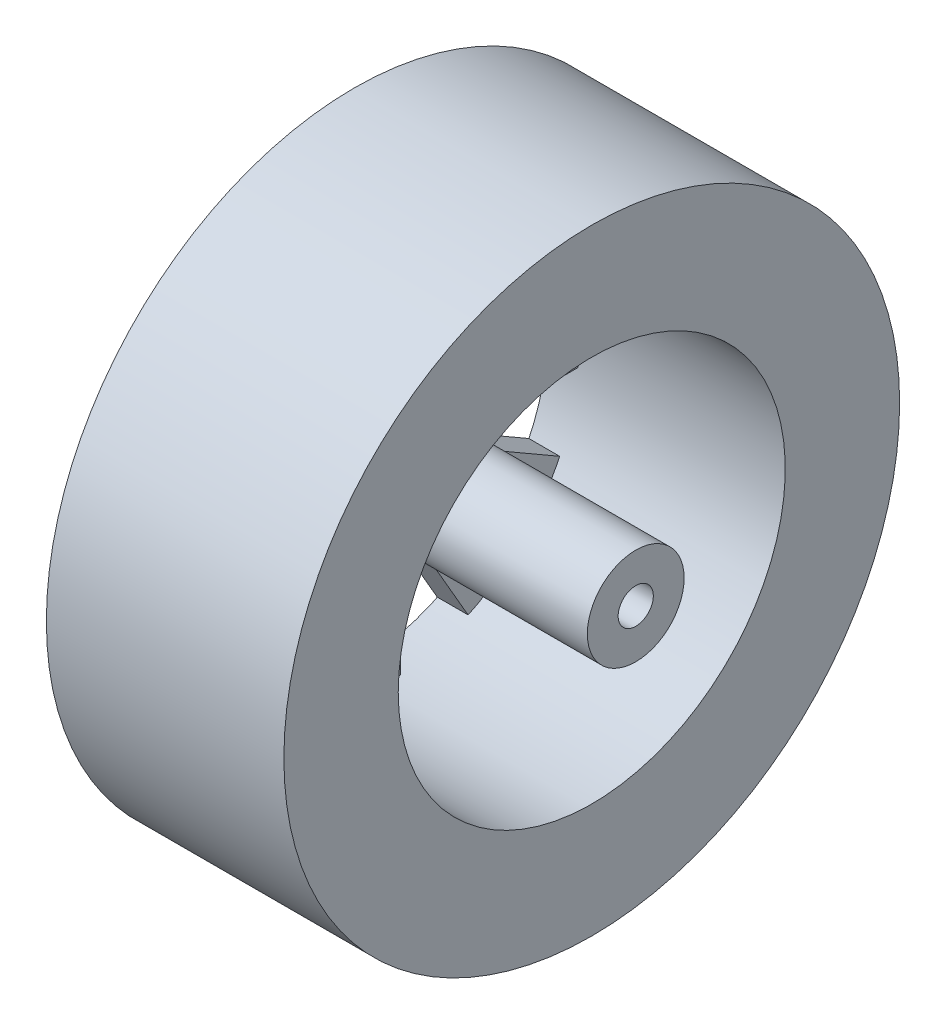
from build123d import *

# Parameters (mm, degrees)
SKETCH1_W              = 27
SKETCH1_H              = 13
SKETCH1_H_2            = 3.5
SKETCH3_R              = 5.5
SKETCH3_R_2            = 2
BOSS_EXTRUDE1_DEPTH    = 5
SKETCH4_R              = 8.75
BOSS_EXTRUDE2_DEPTH    = 3.5
BOSS_EXTRUDE3_DEPTH    = 3.5
BOSS_EXTRUDE3_2_DEPTH  = 3.5
BOSS_EXTRUDE3_3_DEPTH  = 3.5
BOSS_EXTRUDE3_4_DEPTH  = 3.5
BOSS_EXTRUDE3_5_DEPTH  = 3.5
BOSS_EXTRUDE3_6_DEPTH  = 3.5
BOSS_EXTRUDE3_7_DEPTH  = 3.5
BOSS_EXTRUDE3_8_DEPTH  = 3.5
BOSS_EXTRUDE3_9_DEPTH  = 3.5
BOSS_EXTRUDE3_10_DEPTH = 3.5
BOSS_EXTRUDE3_11_DEPTH = 3.5
BOSS_EXTRUDE3_12_DEPTH = 3.5


with BuildPart() as part:
    # Sketch1 → Revolve2 (revolve)
    with BuildSketch(Plane.XY, mode=Mode.PRIVATE) as revolve2_sk:
        with Locations((13.5, 28.5)):
            Rectangle(SKETCH1_W, SKETCH1_H)
        with Locations((13.5, 3.75)):
            Rectangle(SKETCH1_W, SKETCH1_H_2)
    revolve(revolve2_sk.sketch.rotate(Axis((0, 0, 0), (1, 0, 0)), 90), axis=Axis((0, 0, 0), (1, 0, 0)))

    # Sketch3 → Boss-Extrude1 (add)
    with BuildSketch(Plane(origin=(27, 0, 0), x_dir=(0, 0, -1), z_dir=(1, 0, 0))):
        with Locations(Location((0, 0, 0), (0, 0, 180))):
            Circle(SKETCH3_R)
        with Locations(Location((0, 0, 0), (0, 0, 180))):
            Circle(SKETCH3_R_2, mode=Mode.SUBTRACT)
    extrude(amount=BOSS_EXTRUDE1_DEPTH)

    # Sketch4 → Boss-Extrude2 (add)
    with BuildSketch(Plane.ZY):
        Circle(SKETCH4_R)
    extrude(amount=-BOSS_EXTRUDE2_DEPTH)


with BuildPart() as body_2:
    # Sketch5 → Boss-Extrude3 (new body)
    with BuildSketch(Plane.ZY):
        with BuildLine():
            Line((-1.75, 8.5732141), (-1.75, 21.930287276))
            ThreePointArc((-1.75, 21.930287276), (0, 22), (1.75, 21.930287276))
            Line((1.75, 21.930287276), (1.75, 8.5732141))
            ThreePointArc((1.75, 8.5732141), (0, 8.75), (-1.75, 8.5732141))
        make_face()
    extrude(amount=-BOSS_EXTRUDE3_DEPTH)


with BuildPart() as body_3:
    # Sketch5 → Boss-Extrude3 2 (new body)
    with BuildSketch(Plane.ZY):
        with BuildLine():
            Line((2.771062593, 8.299621202), (9.449599181, 19.867185893))
            ThreePointArc((9.449599181, 19.867185893), (11, 19.052558883), (12.480688095, 18.117185893))
            Line((12.480688095, 18.117185893), (5.802151506, 6.549621202))
            ThreePointArc((5.802151506, 6.549621202), (4.375, 7.577722283), (2.771062593, 8.299621202))
        make_face()
    extrude(amount=-BOSS_EXTRUDE3_2_DEPTH)


with BuildPart() as body_4:
    # Sketch5 → Boss-Extrude3 3 (new body)
    with BuildSketch(Plane.ZY):
        with BuildLine():
            Line((6.549621202, 5.802151506), (18.117185893, 12.480688095))
            ThreePointArc((18.117185893, 12.480688095), (19.052558883, 11), (19.867185893, 9.449599181))
            Line((19.867185893, 9.449599181), (8.299621202, 2.771062593))
            ThreePointArc((8.299621202, 2.771062593), (7.577722283, 4.375), (6.549621202, 5.802151506))
        make_face()
    extrude(amount=-BOSS_EXTRUDE3_3_DEPTH)


with BuildPart() as body_5:
    # Sketch5 → Boss-Extrude3 4 (new body)
    with BuildSketch(Plane.ZY):
        with BuildLine():
            Line((8.5732141, 1.75), (21.930287276, 1.75))
            ThreePointArc((21.930287276, 1.75), (22, 0), (21.930287276, -1.75))
            Line((21.930287276, -1.75), (8.5732141, -1.75))
            ThreePointArc((8.5732141, -1.75), (8.75, 0), (8.5732141, 1.75))
        make_face()
    extrude(amount=-BOSS_EXTRUDE3_4_DEPTH)


with BuildPart() as body_6:
    # Sketch5 → Boss-Extrude3 5 (new body)
    with BuildSketch(Plane.ZY):
        with BuildLine():
            Line((8.299621202, -2.771062593), (19.867185893, -9.449599181))
            ThreePointArc((19.867185893, -9.449599181), (19.052558883, -11), (18.117185893, -12.480688095))
            Line((18.117185893, -12.480688095), (6.549621202, -5.802151506))
            ThreePointArc((6.549621202, -5.802151506), (7.577722283, -4.375), (8.299621202, -2.771062593))
        make_face()
    extrude(amount=-BOSS_EXTRUDE3_5_DEPTH)


with BuildPart() as body_7:
    # Sketch5 → Boss-Extrude3 6 (new body)
    with BuildSketch(Plane.ZY):
        with BuildLine():
            Line((5.802151506, -6.549621202), (12.480688095, -18.117185893))
            ThreePointArc((12.480688095, -18.117185893), (11, -19.052558883), (9.449599181, -19.867185893))
            Line((9.449599181, -19.867185893), (2.771062593, -8.299621202))
            ThreePointArc((2.771062593, -8.299621202), (4.375, -7.577722283), (5.802151506, -6.549621202))
        make_face()
    extrude(amount=-BOSS_EXTRUDE3_6_DEPTH)


with BuildPart() as body_8:
    # Sketch5 → Boss-Extrude3 7 (new body)
    with BuildSketch(Plane.ZY):
        with BuildLine():
            Line((1.75, -8.5732141), (1.75, -21.930287276))
            ThreePointArc((1.75, -21.930287276), (0, -22), (-1.75, -21.930287276))
            Line((-1.75, -21.930287276), (-1.75, -8.5732141))
            ThreePointArc((-1.75, -8.5732141), (0, -8.75), (1.75, -8.5732141))
        make_face()
    extrude(amount=-BOSS_EXTRUDE3_7_DEPTH)


with BuildPart() as body_9:
    # Sketch5 → Boss-Extrude3 8 (new body)
    with BuildSketch(Plane.ZY):
        with BuildLine():
            Line((-2.771062593, -8.299621202), (-9.449599181, -19.867185893))
            ThreePointArc((-9.449599181, -19.867185893), (-11, -19.052558883), (-12.480688095, -18.117185893))
            Line((-12.480688095, -18.117185893), (-5.802151506, -6.549621202))
            ThreePointArc((-5.802151506, -6.549621202), (-4.375, -7.577722283), (-2.771062593, -8.299621202))
        make_face()
    extrude(amount=-BOSS_EXTRUDE3_8_DEPTH)


with BuildPart() as body_10:
    # Sketch5 → Boss-Extrude3 9 (new body)
    with BuildSketch(Plane.ZY):
        with BuildLine():
            Line((-6.549621202, -5.802151506), (-18.117185893, -12.480688095))
            ThreePointArc((-18.117185893, -12.480688095), (-19.052558883, -11), (-19.867185893, -9.449599181))
            Line((-19.867185893, -9.449599181), (-8.299621202, -2.771062593))
            ThreePointArc((-8.299621202, -2.771062593), (-7.577722283, -4.375), (-6.549621202, -5.802151506))
        make_face()
    extrude(amount=-BOSS_EXTRUDE3_9_DEPTH)


with BuildPart() as body_11:
    # Sketch5 → Boss-Extrude3 10 (new body)
    with BuildSketch(Plane.ZY):
        with BuildLine():
            Line((-8.5732141, -1.75), (-21.930287276, -1.75))
            ThreePointArc((-21.930287276, -1.75), (-22, 0), (-21.930287276, 1.75))
            Line((-21.930287276, 1.75), (-8.5732141, 1.75))
            ThreePointArc((-8.5732141, 1.75), (-8.75, 0), (-8.5732141, -1.75))
        make_face()
    extrude(amount=-BOSS_EXTRUDE3_10_DEPTH)


with BuildPart() as body_12:
    # Sketch5 → Boss-Extrude3 11 (new body)
    with BuildSketch(Plane.ZY):
        with BuildLine():
            Line((-8.299621202, 2.771062593), (-19.867185893, 9.449599181))
            ThreePointArc((-19.867185893, 9.449599181), (-19.052558883, 11), (-18.117185893, 12.480688095))
            Line((-18.117185893, 12.480688095), (-6.549621202, 5.802151506))
            ThreePointArc((-6.549621202, 5.802151506), (-7.577722283, 4.375), (-8.299621202, 2.771062593))
        make_face()
    extrude(amount=-BOSS_EXTRUDE3_11_DEPTH)


with BuildPart() as body_13:
    # Sketch5 → Boss-Extrude3 12 (new body)
    with BuildSketch(Plane.ZY):
        with BuildLine():
            Line((-5.802151506, 6.549621202), (-12.480688095, 18.117185893))
            ThreePointArc((-12.480688095, 18.117185893), (-11, 19.052558883), (-9.449599181, 19.867185893))
            Line((-9.449599181, 19.867185893), (-2.771062593, 8.299621202))
            ThreePointArc((-2.771062593, 8.299621202), (-4.375, 7.577722283), (-5.802151506, 6.549621202))
        make_face()
    extrude(amount=-BOSS_EXTRUDE3_12_DEPTH)


solid = Compound([part.part, body_2.part, body_3.part, body_4.part, body_5.part, body_6.part, body_7.part, body_8.part, body_9.part, body_10.part, body_11.part, body_12.part, body_13.part])
